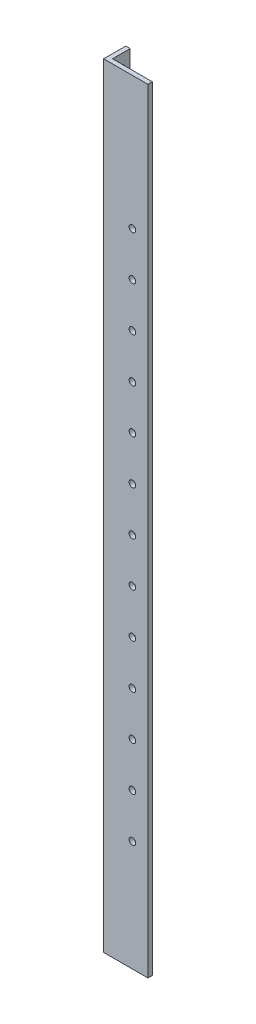
from build123d import *

# Parameters (mm, degrees)
BOSS_EXTRUDE1_DEPTH      = 350
F_3_0_3_DIAMETER_HOLE1_D = 3
F_3_0_3_DIAMETER_HOLE2_D = 3
SKETCH6_R                = 1.5
CUT_EXTRUDE1_DEPTH       = 351.713558335


with BuildPart() as part:
    # Sketch1 → Boss-Extrude1 (new body)
    with BuildSketch(Plane(origin=(0, 0, 0), x_dir=(1, 0, 0), z_dir=(0, 1, 0))):
        Polygon((0, 0), (0, 10), (2, 10), (2, 2), (20, 2), (20, 0), align=None)
    extrude(amount=BOSS_EXTRUDE1_DEPTH)

    # Ø3.0 (3) Diameter Hole1 (through all)
    with Locations(Plane(origin=(2, -11.407632793, -188.67995168), x_dir=(0, 0, -1), z_dir=(1, 0, 0))):
        with Locations((-182.67995168, 17.407632793), (-182.67995168, 31.407632793)):
            Hole(F_3_0_3_DIAMETER_HOLE1_D / 2)

    # Ø3.0 (3) Diameter Hole2 (through all)
    with Locations(Plane(origin=(2, -11.407632793, -188.67995168), x_dir=(0, 0, -1), z_dir=(1, 0, 0))):
        with Locations((-182.67995168, 355.407632793), (-182.67995168, 341.407632793)):
            Hole(F_3_0_3_DIAMETER_HOLE2_D / 2)

    # Sketch6 → Cut-Extrude1 (cut, through all)
    with BuildSketch(Plane.XY):
        with Locations((12.999999986, 290)):
            Circle(SKETCH6_R)
        with Locations((12.999999986, 270)):
            Circle(SKETCH6_R)
        with Locations((12.999999986, 250)):
            Circle(SKETCH6_R)
        with Locations((12.999999986, 230)):
            Circle(SKETCH6_R)
        with Locations((12.999999986, 210)):
            Circle(SKETCH6_R)
        with Locations((12.999999986, 190)):
            Circle(SKETCH6_R)
        with Locations((12.999999986, 170)):
            Circle(SKETCH6_R)
        with Locations((12.999999986, 150)):
            Circle(SKETCH6_R)
        with Locations((12.999999986, 130)):
            Circle(SKETCH6_R)
        with Locations((12.999999986, 110)):
            Circle(SKETCH6_R)
        with Locations((12.999999986, 90)):
            Circle(SKETCH6_R)
        with Locations((12.999999986, 70)):
            Circle(SKETCH6_R)
        with Locations((12.999999986, 50)):
            Circle(SKETCH6_R)
    extrude(amount=-CUT_EXTRUDE1_DEPTH, mode=Mode.SUBTRACT)


solid = part.part
